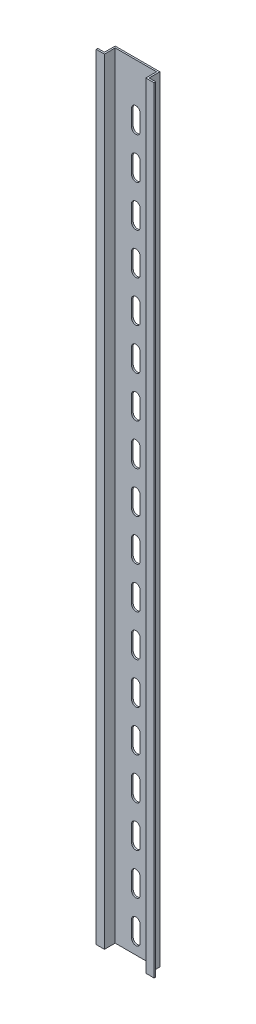
from build123d import *

# Parameters (mm, degrees)
RAIL_DEPTH       = 469
SLOTS_DEPTH      = 470.386301462
SLOTS_DEPTH_BACK = 470.386301462


with BuildPart() as part:
    # Sketch1 → Rail (new body)
    with BuildSketch(Plane(origin=(0, 0, 0), x_dir=(1, 0, 0), z_dir=(0, 1, 0))):
        Polygon((-13.5, 0), (13.5, 0), (13.5, -6.5), (17.5, -6.5), (17.5, -7.5), (12.5, -7.5), (12.5, -1), (-12.5, -1), (-12.5, -7.5), (-17.5, -7.5), (-17.5, -6.5), (-13.5, -6.5), align=None)
    extrude(amount=RAIL_DEPTH)

    # Sketch2 → Slots (cut, two sides: drawn at the far end of the back side and taken through both)
    with BuildSketch(Plane.XY.offset(-SLOTS_DEPTH_BACK)):
        with BuildLine():
            Line((-2.6, 7.6), (-2.6, 17.4))
            ThreePointArc((-2.6, 17.4), (0, 20), (2.6, 17.4))
            Line((2.6, 17.4), (2.6, 7.6))
            ThreePointArc((2.6, 7.6), (0, 5), (-2.6, 7.6))
        make_face()
        with BuildLine():
            Line((-2.6, 32.6), (-2.6, 42.4))
            ThreePointArc((-2.6, 42.4), (0, 45), (2.6, 42.4))
            Line((2.6, 42.4), (2.6, 32.6))
            ThreePointArc((2.6, 32.6), (0, 30), (-2.6, 32.6))
        make_face()
        with BuildLine():
            Line((-2.6, 57.6), (-2.6, 67.4))
            ThreePointArc((-2.6, 67.4), (0, 70), (2.6, 67.4))
            Line((2.6, 67.4), (2.6, 57.6))
            ThreePointArc((2.6, 57.6), (0, 55), (-2.6, 57.6))
        make_face()
        with BuildLine():
            Line((-2.6, 82.6), (-2.6, 92.4))
            ThreePointArc((-2.6, 92.4), (0, 95), (2.6, 92.4))
            Line((2.6, 92.4), (2.6, 82.6))
            ThreePointArc((2.6, 82.6), (0, 80), (-2.6, 82.6))
        make_face()
        with BuildLine():
            Line((-2.6, 107.6), (-2.6, 117.4))
            ThreePointArc((-2.6, 117.4), (0, 120), (2.6, 117.4))
            Line((2.6, 117.4), (2.6, 107.6))
            ThreePointArc((2.6, 107.6), (0, 105), (-2.6, 107.6))
        make_face()
        with BuildLine():
            Line((-2.6, 132.6), (-2.6, 142.4))
            ThreePointArc((-2.6, 142.4), (0, 145), (2.6, 142.4))
            Line((2.6, 142.4), (2.6, 132.6))
            ThreePointArc((2.6, 132.6), (0, 130), (-2.6, 132.6))
        make_face()
        with BuildLine():
            Line((-2.6, 157.6), (-2.6, 167.4))
            ThreePointArc((-2.6, 167.4), (0, 170), (2.6, 167.4))
            Line((2.6, 167.4), (2.6, 157.6))
            ThreePointArc((2.6, 157.6), (0, 155), (-2.6, 157.6))
        make_face()
        with BuildLine():
            Line((-2.6, 182.6), (-2.6, 192.4))
            ThreePointArc((-2.6, 192.4), (0, 195), (2.6, 192.4))
            Line((2.6, 192.4), (2.6, 182.6))
            ThreePointArc((2.6, 182.6), (0, 180), (-2.6, 182.6))
        make_face()
        with BuildLine():
            Line((-2.6, 207.6), (-2.6, 217.4))
            ThreePointArc((-2.6, 217.4), (0, 220), (2.6, 217.4))
            Line((2.6, 217.4), (2.6, 207.6))
            ThreePointArc((2.6, 207.6), (0, 205), (-2.6, 207.6))
        make_face()
        with BuildLine():
            Line((-2.6, 232.6), (-2.6, 242.4))
            ThreePointArc((-2.6, 242.4), (0, 245), (2.6, 242.4))
            Line((2.6, 242.4), (2.6, 232.6))
            ThreePointArc((2.6, 232.6), (0, 230), (-2.6, 232.6))
        make_face()
        with BuildLine():
            Line((-2.6, 257.6), (-2.6, 267.4))
            ThreePointArc((-2.6, 267.4), (0, 270), (2.6, 267.4))
            Line((2.6, 267.4), (2.6, 257.6))
            ThreePointArc((2.6, 257.6), (0, 255), (-2.6, 257.6))
        make_face()
        with BuildLine():
            Line((-2.6, 282.6), (-2.6, 292.4))
            ThreePointArc((-2.6, 292.4), (0, 295), (2.6, 292.4))
            Line((2.6, 292.4), (2.6, 282.6))
            ThreePointArc((2.6, 282.6), (0, 280), (-2.6, 282.6))
        make_face()
        with BuildLine():
            Line((-2.6, 307.6), (-2.6, 317.4))
            ThreePointArc((-2.6, 317.4), (0, 320), (2.6, 317.4))
            Line((2.6, 317.4), (2.6, 307.6))
            ThreePointArc((2.6, 307.6), (0, 305), (-2.6, 307.6))
        make_face()
        with BuildLine():
            Line((-2.6, 332.6), (-2.6, 342.4))
            ThreePointArc((-2.6, 342.4), (0, 345), (2.6, 342.4))
            Line((2.6, 342.4), (2.6, 332.6))
            ThreePointArc((2.6, 332.6), (0, 330), (-2.6, 332.6))
        make_face()
        with BuildLine():
            Line((-2.6, 357.6), (-2.6, 367.4))
            ThreePointArc((-2.6, 367.4), (0, 370), (2.6, 367.4))
            Line((2.6, 367.4), (2.6, 357.6))
            ThreePointArc((2.6, 357.6), (0, 355), (-2.6, 357.6))
        make_face()
        with BuildLine():
            Line((-2.6, 382.6), (-2.6, 392.4))
            ThreePointArc((-2.6, 392.4), (0, 395), (2.6, 392.4))
            Line((2.6, 392.4), (2.6, 382.6))
            ThreePointArc((2.6, 382.6), (0, 380), (-2.6, 382.6))
        make_face()
        with BuildLine():
            Line((-2.6, 407.6), (-2.6, 417.4))
            ThreePointArc((-2.6, 417.4), (0, 420), (2.6, 417.4))
            Line((2.6, 417.4), (2.6, 407.6))
            ThreePointArc((2.6, 407.6), (0, 405), (-2.6, 407.6))
        make_face()
        with BuildLine():
            Line((-2.6, 432.6), (-2.6, 442.4))
            ThreePointArc((-2.6, 442.4), (0, 445), (2.6, 442.4))
            Line((2.6, 442.4), (2.6, 432.6))
            ThreePointArc((2.6, 432.6), (0, 430), (-2.6, 432.6))
        make_face()
    extrude(amount=SLOTS_DEPTH + SLOTS_DEPTH_BACK, mode=Mode.SUBTRACT)


solid = part.part
